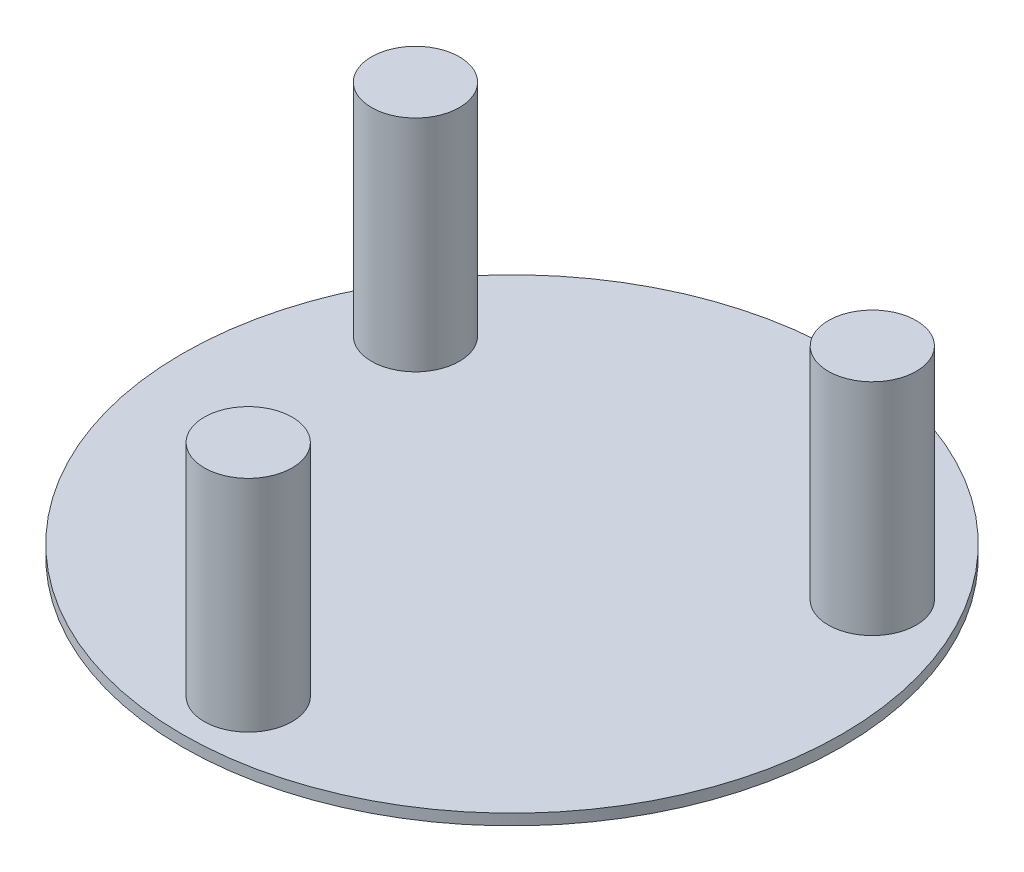
from build123d import *

# Parameters (mm, degrees)
SKETCH_1_R               = 150
EXTRUDE_1_DEPTH          = 5
SKETCH_2_R               = 20
EXTRUDE_2_DEPTH          = 100
PATTERN_CIRCULAR_1_COUNT = 3
SKETCH_3_R               = 2.5
EXTRUDE_3_DEPTH          = 15


with BuildPart() as part:
    # 草图1 → 凸台-拉伸1 (new body)
    with BuildSketch(Plane(origin=(0, 0, 0), x_dir=(1, 0, 0), z_dir=(0, 1, 0))):
        with Locations(Location((0, 0, 0), (0, 0, 270))):
            Circle(SKETCH_1_R)
    extrude(amount=EXTRUDE_1_DEPTH)

    # 草图2 → 凸台-拉伸2 (add)
    with BuildSketch(Plane(origin=(0, 5, 0), x_dir=(1, 0, 0), z_dir=(0, 1, 0))):
        with Locations(Location((0, -120, 0), (0, 0, 270))):
            Circle(SKETCH_2_R)
    extrude_2 = extrude(amount=EXTRUDE_2_DEPTH)

    # 阵列(圆周)1: 凸台-拉伸2 ×3 about axis
    pattern_circular_1_axis = Axis((0, 0, 0), (0, 1, 0))
    for i in range(1, PATTERN_CIRCULAR_1_COUNT):
        add(extrude_2.rotate(pattern_circular_1_axis, i * 360 / PATTERN_CIRCULAR_1_COUNT))

    # 草图3 → 凸台-拉伸3 (add)
    with BuildSketch(Plane.XZ):
        with Locations(Location((0, 0, 0), (0, 0, 90))):
            Circle(SKETCH_3_R)
    extrude(amount=EXTRUDE_3_DEPTH)


solid = part.part
